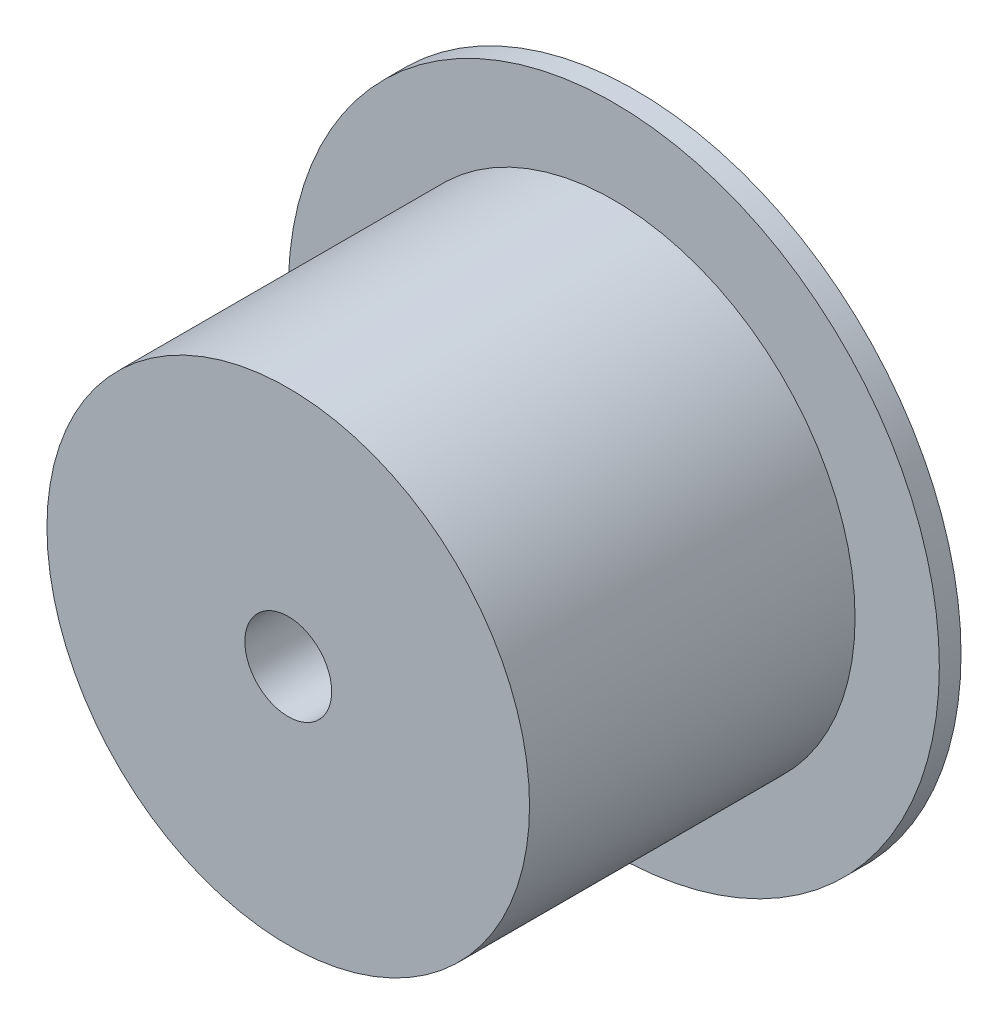
from build123d import *

# Parameters (mm, degrees)
IZIM1_R                     = 15
Y_KSEKLIK_EKSTR_ZYON1_DEPTH = 1
IZIM2_R                     = 11.118013459
Y_KSEKLIK_EKSTR_ZYON2_DEPTH = 15
IZIM3_R                     = 2
KES_EKSTR_ZYON1_DEPTH       = 38.810359459


with BuildPart() as part:
    # Çizim1 → Yükseklik-Ekstrüzyon1 (new body)
    with BuildSketch(Plane.XY):
        with Locations((-15.799728609, 0)):
            Circle(IZIM1_R)
    extrude(amount=Y_KSEKLIK_EKSTR_ZYON1_DEPTH)

    # Çizim2 → Yükseklik-Ekstrüzyon2 (add)
    with BuildSketch(Plane.XY.offset(1)):
        with Locations((-15.799728609, 0)):
            Circle(IZIM2_R)
    extrude(amount=Y_KSEKLIK_EKSTR_ZYON2_DEPTH)

    # Çizim3 → Kes-Ekstrüzyon1 (cut, through all)
    with BuildSketch(Plane.XY.offset(16)):
        with Locations((-15.799728609, 0)):
            Circle(IZIM3_R)
    extrude(amount=-KES_EKSTR_ZYON1_DEPTH, mode=Mode.SUBTRACT)


solid = part.part
